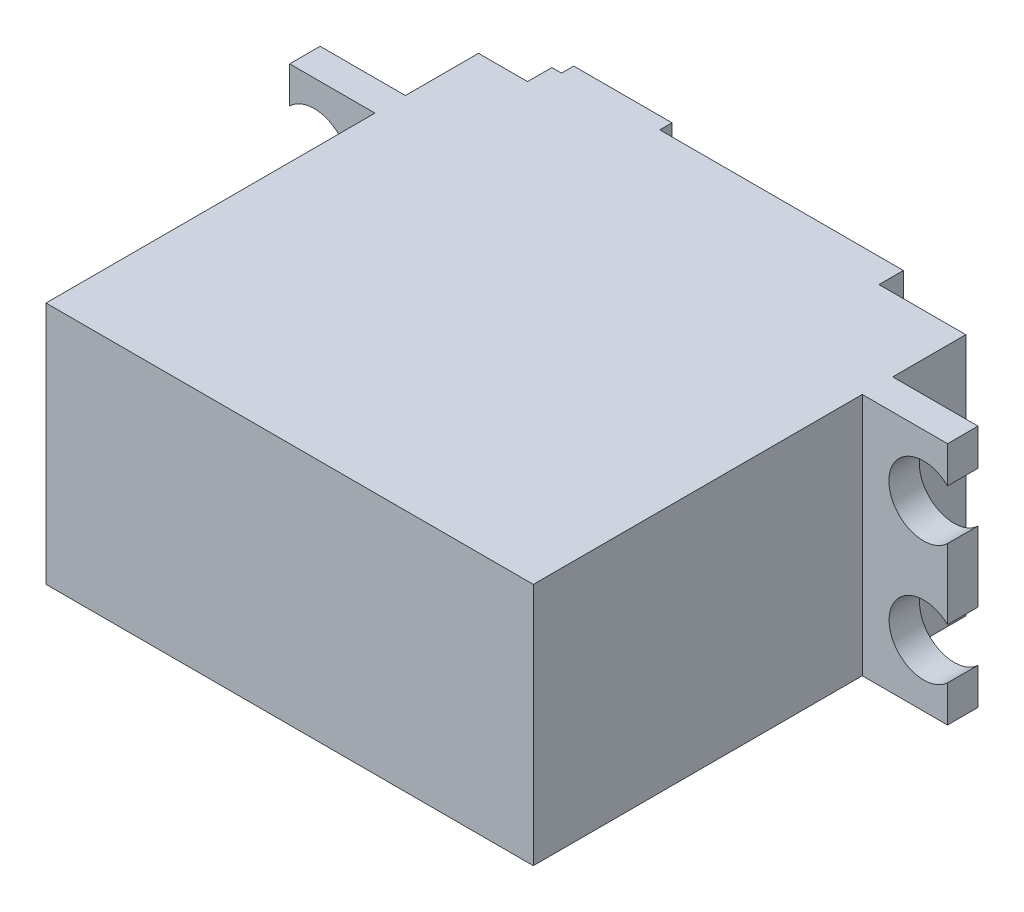
from build123d import *

# Parameters (mm, degrees)
BOSS_EXTRUDE1_DEPTH     = 20
SKETCH2_W               = 3.154933035
SKETCH2_H               = 9.663476497
CUT_EXTRUDE1_DEPTH      = 4
SKETCH3_W               = 3
SKETCH3_H               = 7
CUT_EXTRUDE2_DEPTH      = 4
SKETCH4_R               = 1.281422033
BOSS_EXTRUDE3_DEPTH     = 1
CUT_EXTRUDE3_DEPTH      = 79.790553635
CUT_EXTRUDE3_DEPTH_BACK = 79.790553635
CUT_EXTRUDE4_DEPTH      = 79.790553635
CUT_EXTRUDE4_DEPTH_BACK = 79.790553635


with BuildPart() as part:
    # Sketch1 → Boss-Extrude1 (new body)
    with BuildSketch(Plane(origin=(0, 0, 0), x_dir=(1, 0, 0), z_dir=(0, 1, 0))):
        Polygon((-59.245647318, 22.93293572), (-63.268779285, 22.93293572), (-63.268779285, 16.93293572), (-70.268779285, 16.93293572), (-70.268779285, 14.43293572), (-63.268779285, 14.43293572), (-63.268779285, -12.56706428), (-23.268779285, -12.56706428), (-23.268779285, 14.43293572), (-16.268779285, 14.43293572), (-16.268779285, 16.93293572), (-23.268779285, 16.93293572), (-23.268779285, 22.93293572), (-30.393090753, 22.93293572), (-30.393090753, 24.93293572), (-50.386032487, 24.93293572), (-50.386032487, 25.935013561), (-54.386032487, 25.935013561), (-54.386032487, 29.935013561), (-57.386032487, 29.935013561), (-57.386032487, 25.935013561), (-58.4541935, 25.935013561), (-58.4541935, 24.93293572), (-59.245647318, 24.93293572), align=None)
    extrude(amount=BOSS_EXTRUDE1_DEPTH)

    # Sketch2 → Cut-Extrude1 (cut)
    with BuildSketch(Plane(origin=(0, 0, -25.935013561), x_dir=(-1, 0, 0), z_dir=(0, 0, -1))):
        with Locations((55.851514708, 4.096059823)):
            Rectangle(SKETCH2_W, SKETCH2_H)
    extrude(amount=CUT_EXTRUDE1_DEPTH, mode=Mode.SUBTRACT)

    # Sketch3 → Cut-Extrude2 (cut)
    with BuildSketch(Plane(origin=(0, 0, -29.935013561), x_dir=(-1, 0, 0), z_dir=(0, 0, -1))):
        with Locations((55.886032487, 16.5)):
            Rectangle(SKETCH3_W, SKETCH3_H)
    extrude(amount=-CUT_EXTRUDE2_DEPTH, mode=Mode.SUBTRACT)

    # Sketch4 → Boss-Extrude3 (add)
    with BuildSketch(Plane(origin=(0, 0, -29.935013561), x_dir=(-1, 0, 0), z_dir=(0, 0, -1))):
        with Locations(Location((55.79519526, 11.102128328, 0), (0, 0, 180))):
            Circle(SKETCH4_R)
    extrude(amount=BOSS_EXTRUDE3_DEPTH)

    # Sketch5 → Cut-Extrude3 (cut, two sides: drawn at the far end of the back side and taken through both)
    with BuildSketch(Plane(origin=(0, 0, -16.93293572), x_dir=(-1, 0, 0), z_dir=(0, 0, -1)).offset(-CUT_EXTRUDE3_DEPTH_BACK)):
        with BuildLine():
            Line((70.268779285, 12.977163389), (70.268779285, 17))
            ThreePointArc((70.268779285, 17), (65.412785932, 14.988581694), (70.268779285, 12.977163389))
        make_face()
        with BuildLine():
            Line((70.268779285, 3), (70.268779285, 7.004039222))
            ThreePointArc((70.268779285, 7.004039222), (65.403430944, 5.002019611), (70.268779285, 3))
        make_face()
    extrude(amount=CUT_EXTRUDE3_DEPTH + CUT_EXTRUDE3_DEPTH_BACK, mode=Mode.SUBTRACT)

    # Sketch6 → Cut-Extrude4 (cut, two sides: drawn at the far end of the back side and taken through both)
    with BuildSketch(Plane(origin=(0, 0, -16.93293572), x_dir=(-1, 0, 0), z_dir=(0, 0, -1)).offset(-CUT_EXTRUDE4_DEPTH_BACK)):
        with BuildLine():
            Line((16.268779285, 17), (16.268779285, 12.89909256))
            ThreePointArc((16.268779285, 12.89909256), (21.084964529, 14.94954628), (16.268779285, 17))
        make_face()
        with BuildLine():
            Line((16.268779285, 7.134169091), (16.268779285, 3))
            ThreePointArc((16.268779285, 3), (21.067521343, 5.067084545), (16.268779285, 7.134169091))
        make_face()
    extrude(amount=CUT_EXTRUDE4_DEPTH + CUT_EXTRUDE4_DEPTH_BACK, mode=Mode.SUBTRACT)


solid = part.part
